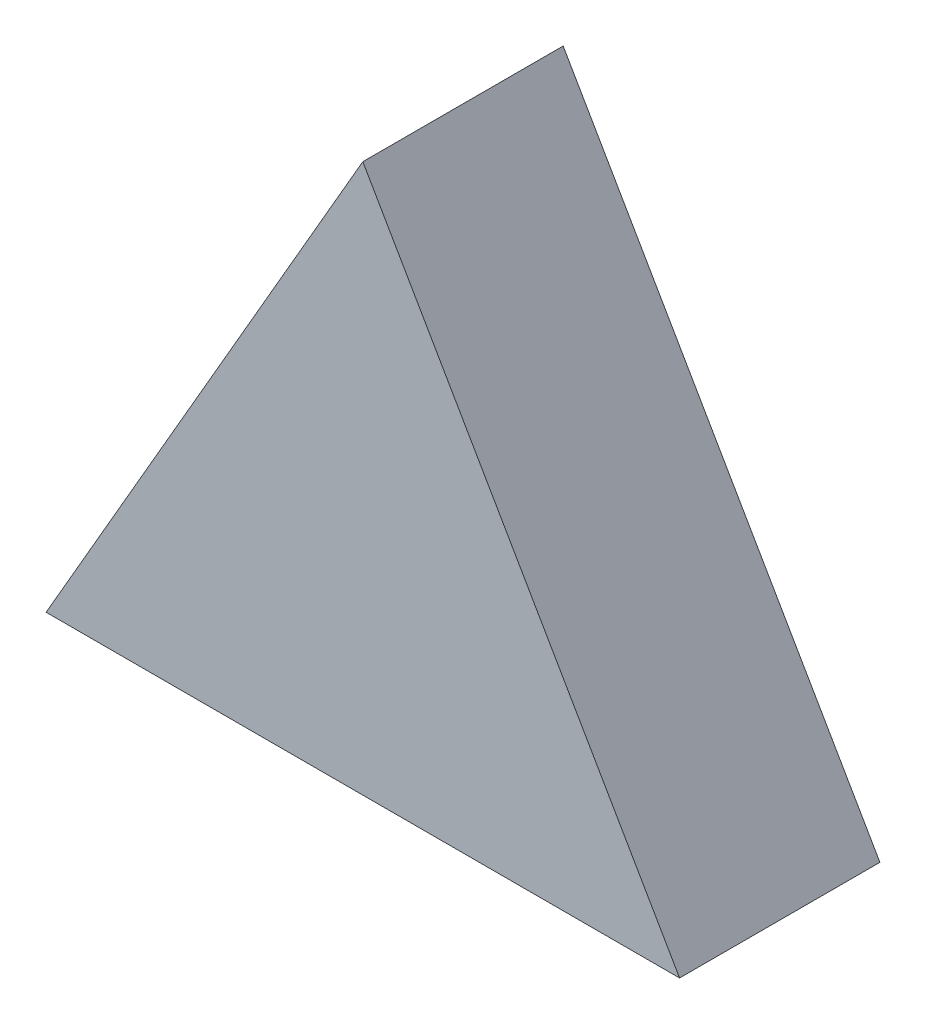
from build123d import *

# Parameters (mm, degrees)
BOSS_EXTRUDE1_DEPTH = 64.262


with BuildPart() as part:
    # Sketch1 → Boss-Extrude1 (new body)
    with BuildSketch(Plane.XY):
        Polygon((0, 117.317574699), (-101.6, -58.65878735), (101.6, -58.65878735), align=None)
    extrude(amount=BOSS_EXTRUDE1_DEPTH)


solid = part.part
